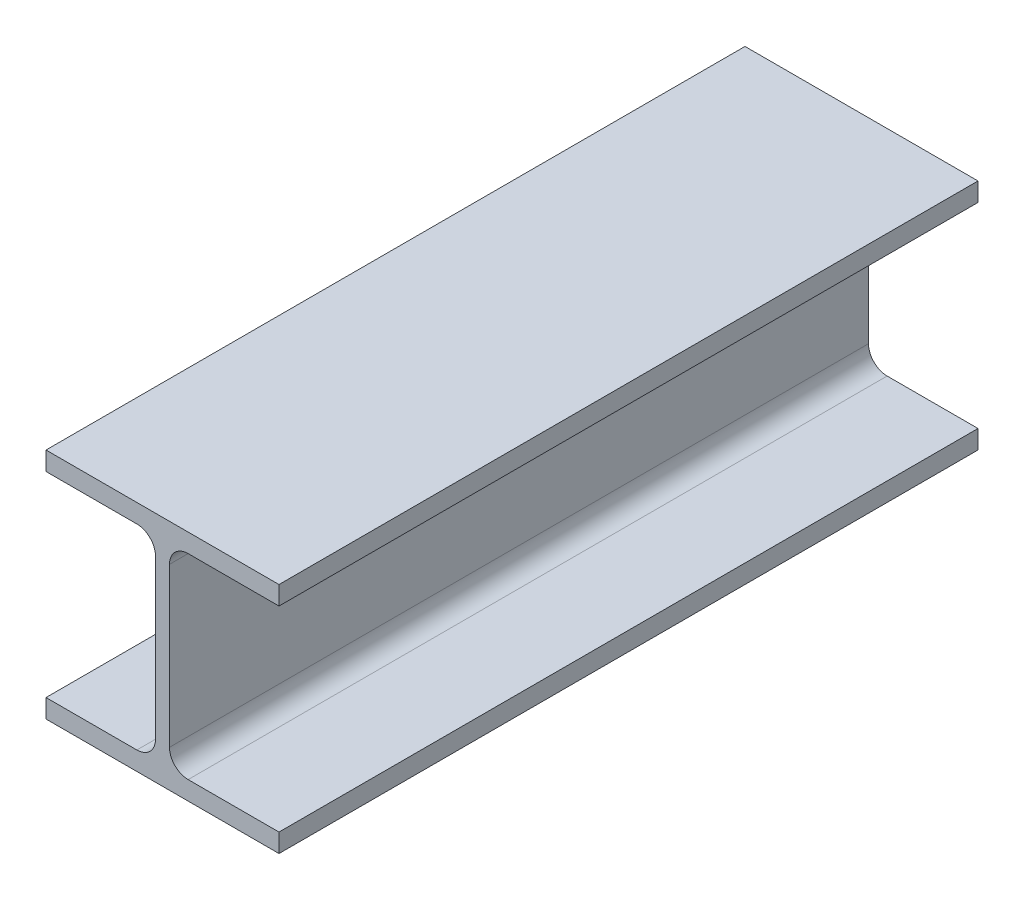
from build123d import *

# Parameters (mm, degrees)
EXTRUDE_1_DEPTH = 300


with BuildPart() as part:
    # 草图1 → 拉伸1 (new body)
    with BuildSketch(Plane.XY):
        with BuildLine():
            Line((50, -50), (-50, -50))
            Line((-50, -50), (-50, -42))
            Line((-50, -42), (-11, -42))
            ThreePointArc((-11, -42), (-5.343145751, -39.656854249), (-3, -34))
            Line((-3, -34), (-3, 34))
            ThreePointArc((-3, 34), (-5.343145751, 39.656854249), (-11, 42))
            Line((-11, 42), (-50, 42))
            Line((-50, 42), (-50, 50))
            Line((-50, 50), (50, 50))
            Line((50, 50), (50, 42))
            Line((50, 42), (11, 42))
            ThreePointArc((11, 42), (5.343145751, 39.656854249), (3, 34))
            Line((3, 34), (3, -34))
            ThreePointArc((3, -34), (5.343145751, -39.656854249), (11, -42))
            Line((11, -42), (50, -42))
            Line((50, -42), (50, -50))
        make_face()
    extrude(amount=EXTRUDE_1_DEPTH)


solid = part.part
